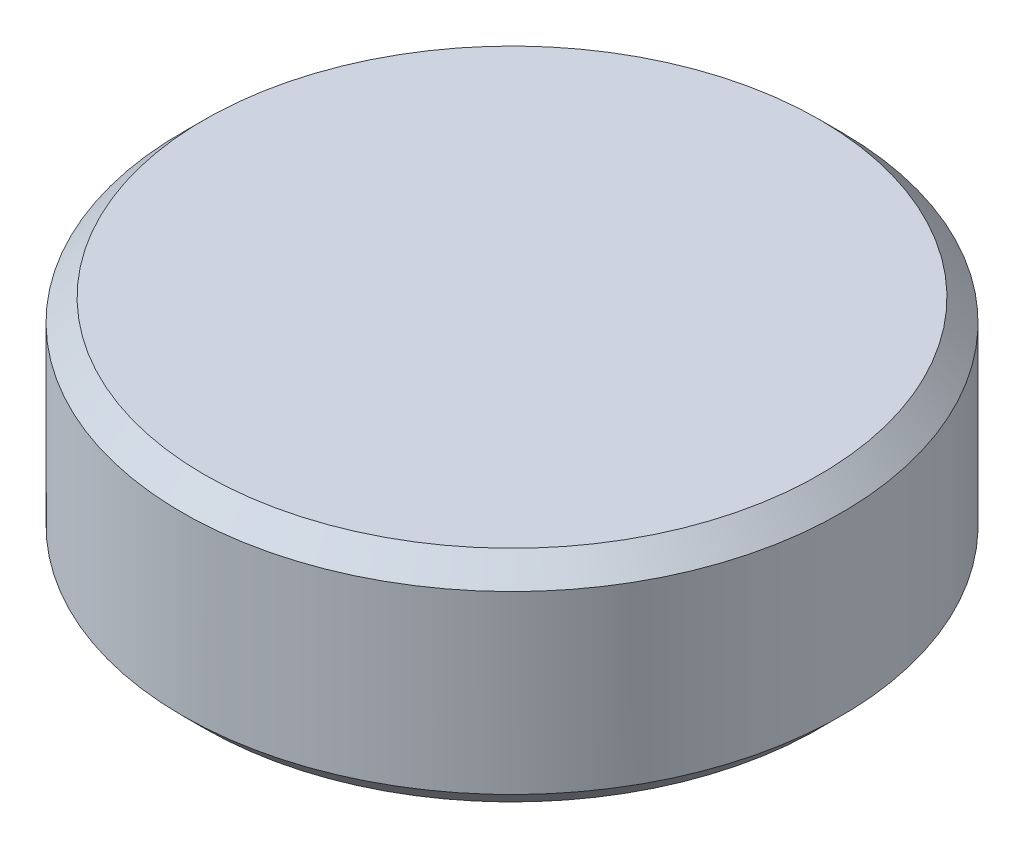
from build123d import *

# Parameters (mm, degrees)
SKETCH1_R           = 3
BOSS_EXTRUDE1_DEPTH = 2
CHAMFER1_SIZE       = 0.2


with BuildPart() as part:
    # Sketch1 → Boss-Extrude1 (new body)
    with BuildSketch(Plane(origin=(0, 0, 0), x_dir=(1, 0, 0), z_dir=(0, 1, 0))):
        with Locations(Location((0, 0, 0), (0, 0, 270))):
            Circle(SKETCH1_R)
    extrude(amount=BOSS_EXTRUDE1_DEPTH)

    # Chamfer1
    chamfer1_edges = [part.edges().sort_by_distance(p)[0] for p in [
        (0, 0, -3),
        (0, 2, -3),
    ]]
    chamfer(chamfer1_edges, length=CHAMFER1_SIZE)


solid = part.part
